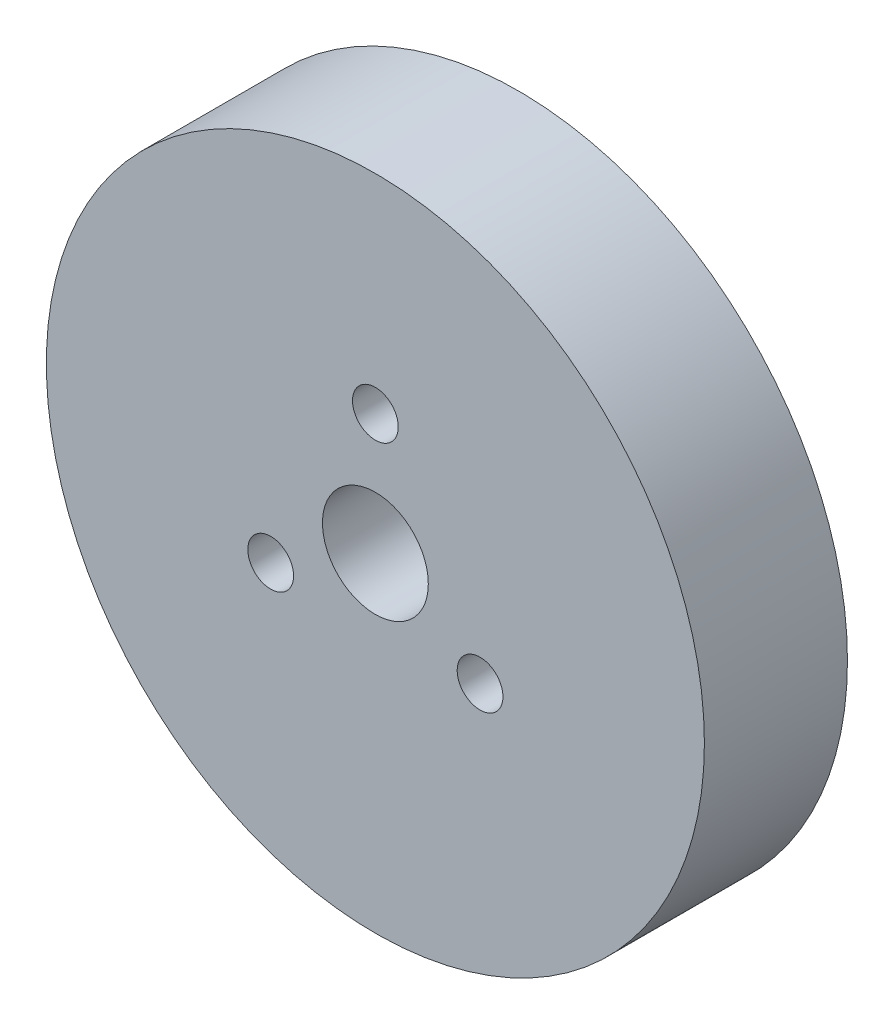
from build123d import *

# Parameters (mm, degrees)
SKETCH1_R           = 23
SKETCH1_R_2         = 3.7
BOSS_EXTRUDE1_DEPTH = 10
HOLE1_D             = 3.2


with BuildPart() as part:
    # Sketch1 → Boss-Extrude1 (new body)
    with BuildSketch(Plane.XY):
        Circle(SKETCH1_R)
        Circle(SKETCH1_R_2, mode=Mode.SUBTRACT)
    extrude(amount=BOSS_EXTRUDE1_DEPTH)

    # Hole1 (through all)
    with Locations(Plane(origin=(0, 8.45, 0), x_dir=(-1, 0, 0), z_dir=(0, 0, -1))):
        with Locations((0, 0), (-7.317914662, -12.675), (7.317914662, -12.675)):
            Hole(HOLE1_D / 2)


solid = part.part
